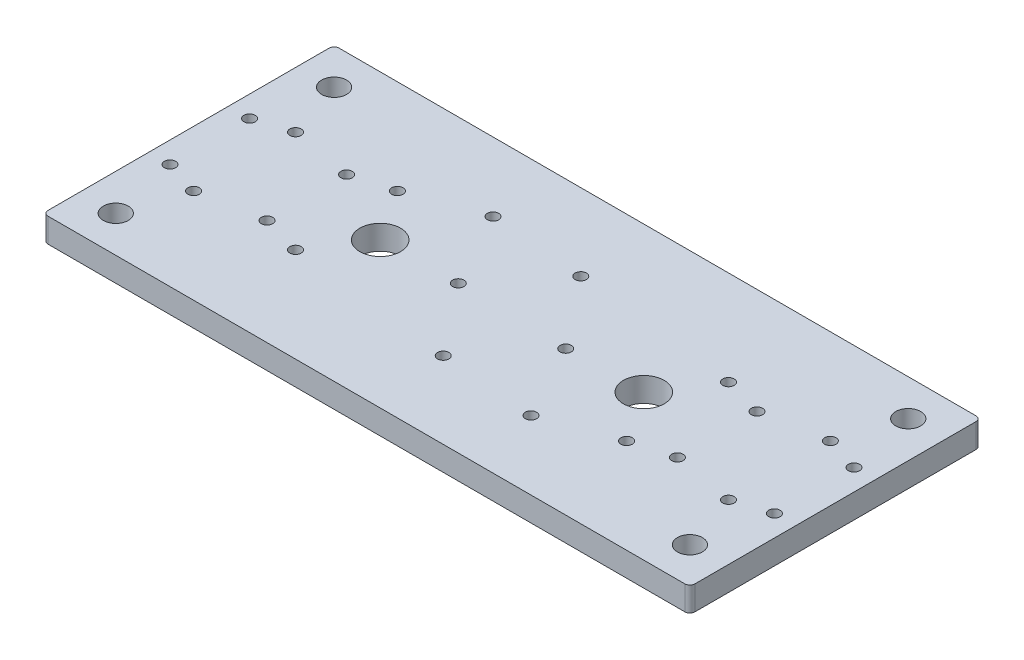
from build123d import *

# Parameters (mm, degrees)
SKETCH1_W                   = 254
SKETCH1_H                   = 114.3
BOSS_EXTRUDE1_DEPTH         = 9.525
M3_CLEARANCE_HOLE1_D        = 4.45
M3_CLEARANCE_HOLE1_DEPTH    = 10
M3_CLEARANCE_HOLE1_TIP      = 1.336914877
F_3_8_CLEARANCE_HOLE1_D     = 9.8044
F_3_8_CLEARANCE_HOLE1_DEPTH = 10
F_3_8_CLEARANCE_HOLE1_TIP   = 2.945538927
M3_CLEARANCE_HOLE2_D        = 4.45
M3_CLEARANCE_HOLE2_DEPTH    = 10
M3_CLEARANCE_HOLE2_TIP      = 1.336914877
FILLET1_R                   = 2
M3_CLEARANCE_HOLE4_D        = 4.45
M3_CLEARANCE_HOLE4_DEPTH    = 10
M3_CLEARANCE_HOLE4_TIP      = 1.336914877
SKETCH18_R                  = 8
CUT_EXTRUDE1_DEPTH          = 140.5917194


with BuildPart() as part:
    # Sketch1 → Boss-Extrude1 (new body)
    with BuildSketch(Plane(origin=(0, 0, 0), x_dir=(1, 0, 0), z_dir=(0, 1, 0))):
        Rectangle(SKETCH1_W, SKETCH1_H)
    extrude(amount=BOSS_EXTRUDE1_DEPTH)

    # M3 Clearance Hole1
    with Locations(Plane(origin=(0, 9.525, 0), x_dir=(1, 0, 0), z_dir=(0, 1, 0))):
        with Locations((-80.5625, -15.621), (-80.5625, 15.621), (-118.6625, -15.621), (-118.6625, 15.621), (118.6625, -15.621), (80.5625, -15.621), (80.5625, 15.621), (118.6625, 15.621)):
            Hole(M3_CLEARANCE_HOLE1_D / 2, depth=M3_CLEARANCE_HOLE1_DEPTH)
            with Locations((0, 0, -(M3_CLEARANCE_HOLE1_DEPTH + M3_CLEARANCE_HOLE1_TIP / 2))):  # 118° drill point
                Cone(0, M3_CLEARANCE_HOLE1_D / 2, M3_CLEARANCE_HOLE1_TIP, mode=Mode.SUBTRACT)

    # 3/8 Clearance Hole1
    with Locations(Plane(origin=(0, 0, 0), x_dir=(-1, 0, 0), z_dir=(0, -1, 0))):
        with Locations((-112.7125, 42.8625), (-112.7125, -42.8625), (112.7125, -42.8625), (112.7125, 42.8625)):
            Hole(F_3_8_CLEARANCE_HOLE1_D / 2, depth=F_3_8_CLEARANCE_HOLE1_DEPTH)
            with Locations((0, 0, -(F_3_8_CLEARANCE_HOLE1_DEPTH + F_3_8_CLEARANCE_HOLE1_TIP / 2))):  # 118° drill point
                Cone(0, F_3_8_CLEARANCE_HOLE1_D / 2, F_3_8_CLEARANCE_HOLE1_TIP, mode=Mode.SUBTRACT)

    # M3 Clearance Hole2
    with Locations(Plane.XZ):
        with Locations((105, 20), (65, -20), (105, -20), (65, 20), (-65, -20), (-65, 20), (-105, 20), (-105, -20)):
            Hole(M3_CLEARANCE_HOLE2_D / 2, depth=M3_CLEARANCE_HOLE2_DEPTH)
            with Locations((0, 0, -(M3_CLEARANCE_HOLE2_DEPTH + M3_CLEARANCE_HOLE2_TIP / 2))):  # 118° drill point
                Cone(0, M3_CLEARANCE_HOLE2_D / 2, M3_CLEARANCE_HOLE2_TIP, mode=Mode.SUBTRACT)

    # Fillet1
    fillet1_edges = [part.edges().sort_by_distance(p)[0] for p in [
        (-127, 4.7625, -57.15),
        (127, 4.7625, -57.15),
        (127, 4.7625, 57.15),
        (-127, 4.7625, 57.15),
    ]]
    fillet(fillet1_edges, radius=FILLET1_R)

    # M3 Clearance Hole4
    with Locations(Plane.XZ):
        with Locations((0, -27), (-21.65, -0.55), (-37.55, -30.1), (37.55, 30.1), (21.65, 0.55), (0, 27)):
            Hole(M3_CLEARANCE_HOLE4_D / 2, depth=M3_CLEARANCE_HOLE4_DEPTH)
            with Locations((0, 0, -(M3_CLEARANCE_HOLE4_DEPTH + M3_CLEARANCE_HOLE4_TIP / 2))):  # 118° drill point
                Cone(0, M3_CLEARANCE_HOLE4_D / 2, M3_CLEARANCE_HOLE4_TIP, mode=Mode.SUBTRACT)

    # Sketch18 → Cut-Extrude1 (cut, through all)
    with BuildSketch(Plane.XZ):
        with Locations(Location((-51.75, 0, 0), (0, 0, 270))):
            Circle(SKETCH18_R)
        with Locations(Location((51.75, 0, 0), (0, 0, 270))):
            Circle(SKETCH18_R)
    extrude(amount=-CUT_EXTRUDE1_DEPTH, mode=Mode.SUBTRACT)


solid = part.part
